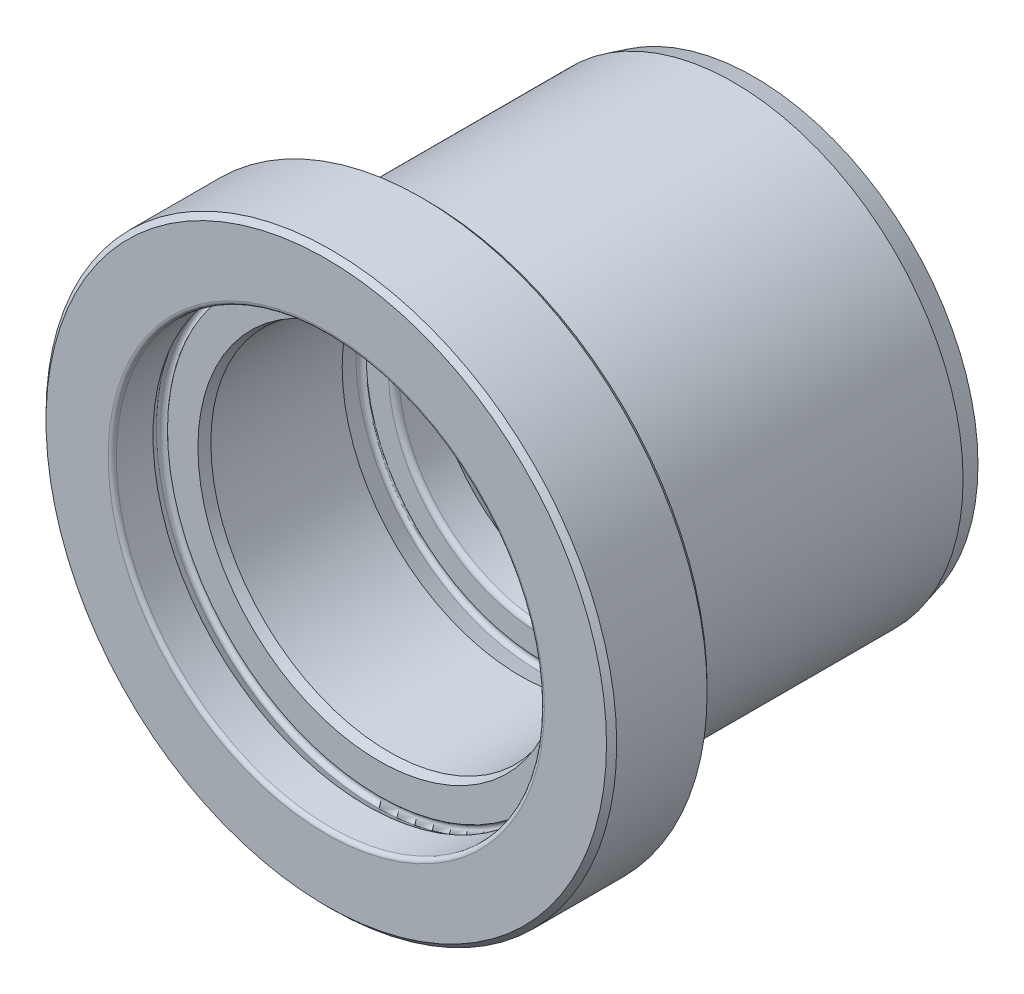
from build123d import *


with BuildPart() as part:
    # Sketch1 → Revolve1 (revolve)
    with BuildSketch(Plane(origin=(0, 0, 0), x_dir=(0, 0, -1), z_dir=(1, 0, 0)), mode=Mode.PRIVATE) as revolve1_sk:
        with BuildLine():
            Line((0, 27.5025), (0, 21.4025))
            ThreePointArc((0, 21.4025), (0.117157288, 21.119657288), (0.4, 21.0025))
            Line((0.4, 21.0025), (4, 21.0025))
            Line((4, 21.0025), (4.776188096, 21.447093398))
            ThreePointArc((4.776188096, 21.447093398), (5.321752289, 21.299406245), (5.175, 20.753589838))
            Line((5.175, 20.753589838), (5.175, 17.770449192))
            Line((5.175, 17.770449192), (6.175, 17.5025))
            Line((6.175, 17.5025), (19.065643724, 17.5025))
            Line((19.065643724, 17.5025), (20.871472382, 17.986370331))
            ThreePointArc((20.871472382, 17.986370331), (21.344551813, 17.753073373), (21.175, 17.253589838))
            Line((21.175, 17.253589838), (21.175, 15.0925))
            ThreePointArc((21.175, 15.0925), (21.321446609, 14.738946609), (21.675, 14.5925))
            Line((21.675, 14.5925), (24.99, 14.5925))
            Line((24.99, 14.5925), (26.619855519, 15.730038226))
            ThreePointArc((26.619855519, 15.730038226), (27.576420826, 15.996790344), (28.49, 15.6075))
            Line((28.49, 15.6075), (37.0475, 15.6075))
            Line((37.0475, 15.6075), (38.94, 17.5))
            Line((38.94, 17.5), (38.94, 18.5375))
            ThreePointArc((38.94, 18.5375), (39.086446609, 18.891053391), (39.44, 19.0375))
            Line((39.44, 19.0375), (41.69, 19.0375))
            ThreePointArc((41.69, 19.0375), (41.902132034, 19.125367966), (41.99, 19.3375))
            Line((41.99, 19.3375), (41.99, 21.966601615))
            Line((41.99, 21.966601615), (39.99, 22.5025))
            Line((39.99, 22.5025), (11.90301653, 22.5025))
            Line((11.90301653, 22.5025), (10.078527618, 22.013629669))
            ThreePointArc((10.078527618, 22.013629669), (9.588161646, 22.298235133), (9.875, 22.787298335))
            Line((9.875, 22.787298335), (9.875, 27.5025))
            Line((9.875, 27.5025), (9.375, 28.0025))
            Line((9.375, 28.0025), (0.5, 28.0025))
            Line((0.5, 28.0025), (0, 27.5025))
        make_face()
    revolve(revolve1_sk.sketch.rotate(Axis((0, 0, 0), (0, 0, -1)), 90), axis=Axis((0, 0, 0), (0, 0, -1)))


solid = part.part
